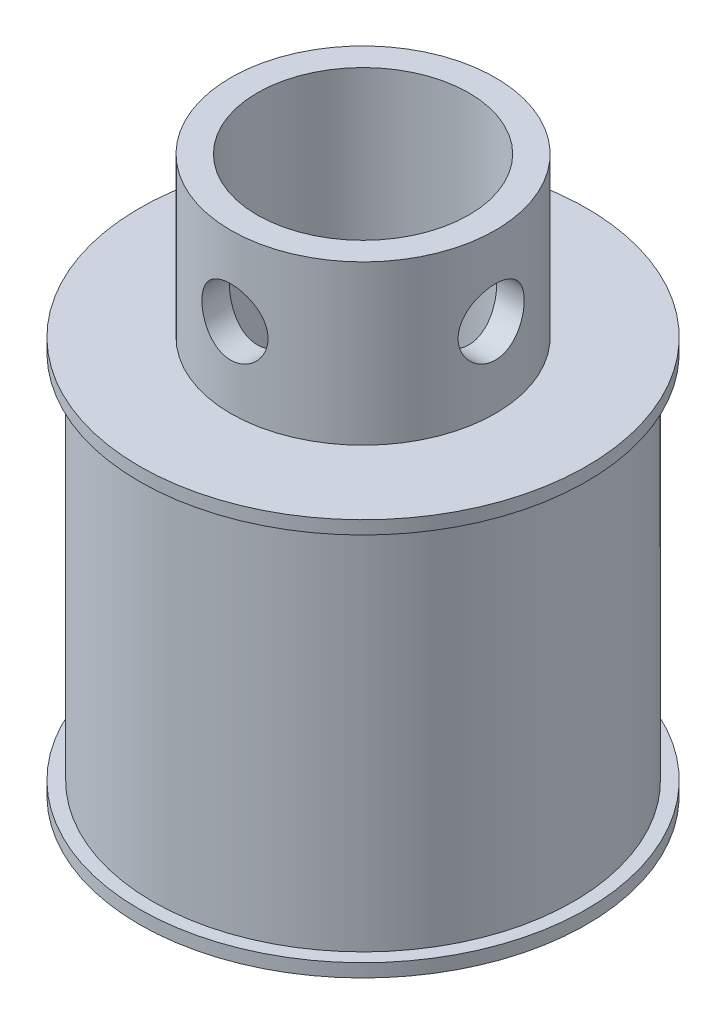
from build123d import *

# Parameters (mm, degrees)
CROQUIS1_R                 = 7.95
SALIENTE_EXTRUIR1_DEPTH    = 7.5
CROQUIS2_R                 = 8.45
SALIENTE_EXTRUIR2_DEPTH    = 0.5
SALIENTE_EXTRUIR3_START    = -14.5
CROQUIS2_2_R               = 8.45
SALIENTE_EXTRUIR3_DEPTH    = 0.5
CROQUIS3_R                 = 5
SALIENTE_EXTRUIR4_DEPTH    = 21
CORTAR_EXTRUIR1_DEPTH      = 24.728779994
CORTAR_EXTRUIR1_DEPTH_BACK = 24.728779994
CROQUIS4_R                 = 3
CROQUIS7_W                 = 1.25
CROQUIS7_H                 = 5
CROQUIS9_W                 = 1.25
CROQUIS9_H                 = 8.45
CROQUIS10_R                = 4
CORTAR_EXTRUIR2_DEPTH      = 25.162057119


with BuildPart() as part:
    # Croquis1 → Saliente-Extruir1 (new, symmetric)
    with BuildSketch(Plane(origin=(0, 0, 0), x_dir=(-1, 0, 0), z_dir=(0, 1, 0))):
        with Locations(Location((0, 0, 0), (0, 0, 90))):
            Circle(CROQUIS1_R)
    extrude(amount=SALIENTE_EXTRUIR1_DEPTH, both=True)

    # Croquis2 → Saliente-Extruir2 (add)
    with BuildSketch(Plane(origin=(0, 7.5, 0), x_dir=(-1, 0, 0), z_dir=(0, 1, 0))):
        with Locations(Location((0, 0, 0), (0, 0, 90))):
            Circle(CROQUIS2_R)
    extrude(amount=-SALIENTE_EXTRUIR2_DEPTH)

    # Croquis2<2> → Saliente-Extruir3 (add)
    with BuildSketch(Plane(origin=(0, 7.5, 0), x_dir=(-1, 0, 0), z_dir=(0, 1, 0)).offset(SALIENTE_EXTRUIR3_START)):
        with Locations(Location((0, 0, 0), (0, 0, 90))):
            Circle(CROQUIS2_2_R)
    extrude(amount=-SALIENTE_EXTRUIR3_DEPTH)

    # Croquis3 → Saliente-Extruir4 (add)
    with BuildSketch(Plane(origin=(0, -7.5, 0), x_dir=(-1, 0, 0), z_dir=(0, 1, 0))):
        with Locations(Location((0, 0, 0), (0, 0, 270))):
            Circle(CROQUIS3_R)
    extrude(amount=SALIENTE_EXTRUIR4_DEPTH)

    # Croquis4 → Cortar-Extruir1 (cut, two sides: drawn at the far end of the back side and taken through both)
    with BuildSketch(Plane(origin=(0, -7, 0), x_dir=(-1, 0, 0), z_dir=(0, 1, 0)).offset(-CORTAR_EXTRUIR1_DEPTH_BACK)):
        with Locations(Location((0, 0, 0), (0, 0, 90))):
            Circle(CROQUIS4_R)
    extrude(amount=CORTAR_EXTRUIR1_DEPTH + CORTAR_EXTRUIR1_DEPTH_BACK, mode=Mode.SUBTRACT)

    # Croquis7 → Taladro roscado M32 (revolve, cut)
    with BuildSketch(Plane.ZX.offset(10.5)):
        with Locations((0.625, 2.5)):
            Rectangle(CROQUIS7_W, CROQUIS7_H)
    revolve(axis=Axis((-6.35, 10.5, 0), (1, 0, 0)), mode=Mode.SUBTRACT)

    # Croquis9 → Taladro roscado M31 (revolve, cut)
    with BuildSketch(Plane(origin=(0, 10.5, 0), x_dir=(0, 1, 0), z_dir=(1, 0, 0))):
        with Locations((0.625, 4.225)):
            Rectangle(CROQUIS9_W, CROQUIS9_H)
    revolve(axis=Axis((0, 10.5, -6.35), (0, 0, 1)), mode=Mode.SUBTRACT)

    # Croquis10 → Cortar-Extruir2 (cut, through all)
    with BuildSketch(Plane.XZ.offset(7.5)):
        with Locations(Location((0, 0, 0), (0, 0, 270))):
            Circle(CROQUIS10_R)
    extrude(amount=-CORTAR_EXTRUIR2_DEPTH, mode=Mode.SUBTRACT)


solid = part.part
